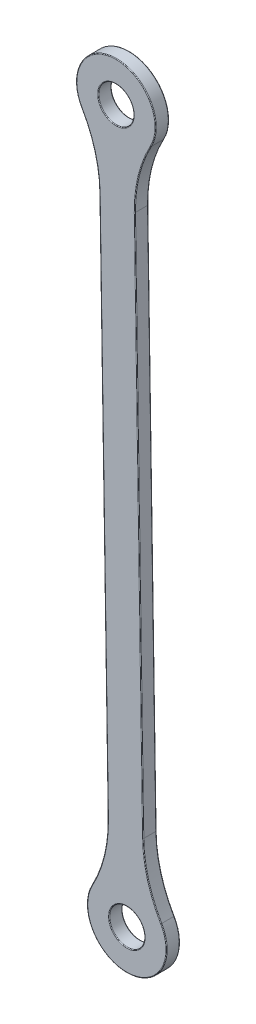
from build123d import *

# Parameters (mm, degrees)
BOSS_EXTRUDE1_DEPTH = 3
FILLET1_R           = 30
FILLET2_R           = 0.15


with BuildPart() as part:
    # Sketch2 → Boss-Extrude1 (new body)
    with BuildSketch(Plane.XY):
        with BuildLine():
            ThreePointArc((40.312003169, 217.259303311), (26.509736802, 224.871020446), (27.436839225, 209.136304824))
            Line((27.436839225, 209.136304824), (27.312479057, 217.197603389))
            ThreePointArc((27.312479057, 217.197603389), (31.250303247, 221.258827422), (35.31152728, 217.321003232))
            Line((35.31152728, 217.321003232), (35.435887448, 209.259704667))
            ThreePointArc((35.435887448, 209.259704667), (38.996889587, 212.575018868), (40.312003169, 217.259303311))
        make_face()
        with BuildLine():
            Line((31.37370309, 213.259779199), (31.450827992, 208.260374059))
            ThreePointArc((31.450827992, 208.260374059), (33.501144014, 208.529603295), (35.435887448, 209.259704667))
            Line((35.435887448, 209.259704667), (35.31152728, 217.321003232))
            ThreePointArc((35.31152728, 217.321003232), (34.183722222, 214.474841123), (31.37370309, 213.259779199))
        make_face()
        with BuildLine():
            ThreePointArc((27.436839225, 209.136304824), (29.393182911, 208.466230536), (31.450827992, 208.260374059))
            Line((31.450827992, 208.260374059), (31.37370309, 213.259779199))
            ThreePointArc((31.37370309, 213.259779199), (28.527540981, 214.387584257), (27.312479057, 217.197603389))
            Line((27.312479057, 217.197603389), (27.436839225, 209.136304824))
        make_face()
        with BuildLine():
            ThreePointArc((29.65611575, 65.277937502), (31.590859184, 66.008038874), (33.641175206, 66.27726811))
            Line((33.641175206, 66.27726811), (31.450827992, 208.260374059))
            ThreePointArc((31.450827992, 208.260374059), (29.393182911, 208.466230536), (27.436839225, 209.136304824))
            Line((27.436839225, 209.136304824), (29.65611575, 65.277937502))
        make_face()
        with BuildLine():
            Line((31.450827992, 208.260374059), (33.641175206, 66.27726811))
            ThreePointArc((33.641175206, 66.27726811), (35.698820288, 66.071411633), (37.655163974, 65.401337345))
            Line((37.655163974, 65.401337345), (35.435887448, 209.259704667))
            ThreePointArc((35.435887448, 209.259704667), (33.501144014, 208.529603295), (31.450827992, 208.260374059))
        make_face()
        with BuildLine():
            ThreePointArc((37.779524141, 57.34003878), (33.841699951, 53.278814747), (29.780475918, 57.216638937))
            Line((29.780475918, 57.216638937), (29.65611575, 65.277937502))
            ThreePointArc((29.65611575, 65.277937502), (29.095715587, 49.593452441), (42.78000003, 57.278338859))
            ThreePointArc((42.78000003, 57.278338859), (41.391717165, 62.080605225), (37.655163974, 65.401337345))
            Line((37.655163974, 65.401337345), (37.779524141, 57.34003878))
        make_face()
        with BuildLine():
            Line((33.641175206, 66.27726811), (33.718300108, 61.27786297))
            ThreePointArc((33.718300108, 61.27786297), (36.564462218, 60.150057912), (37.779524141, 57.34003878))
            Line((37.779524141, 57.34003878), (37.655163974, 65.401337345))
            ThreePointArc((37.655163974, 65.401337345), (35.698820288, 66.071411633), (33.641175206, 66.27726811))
        make_face()
        with BuildLine():
            ThreePointArc((29.780475918, 57.216638937), (30.908280976, 60.062801047), (33.718300108, 61.27786297))
            Line((33.718300108, 61.27786297), (33.641175206, 66.27726811))
            ThreePointArc((33.641175206, 66.27726811), (31.590859184, 66.008038874), (29.65611575, 65.277937502))
            Line((29.65611575, 65.277937502), (29.780475918, 57.216638937))
        make_face()
    extrude(amount=-BOSS_EXTRUDE1_DEPTH)

    # Fillet1
    fillet1_edges = [part.edges().sort_by_distance(p)[0] for p in [
        (29.65611575, 65.277937502, -1.5),
        (27.436839225, 209.136304824, -1.5),
        (35.435887448, 209.259704667, -1.5),
        (37.655163974, 65.401337345, -1.5),
    ]]
    fillet(fillet1_edges, radius=FILLET1_R)

    # Fillet2
    fillet2_edges = [part.edges().sort_by_distance(p)[0] for p in [
        (27.312479057, 217.197603389, -3),
        (28.546477487, 137.207121163, 0),
        (28.546477487, 137.207121163, -3),
        (31.568557037, 48.554261836, 0),
        (31.568557037, 48.554261836, -3),
        (36.545525711, 137.330521006, 0),
        (37.779524141, 57.34003878, -3),
        (36.545525711, 137.330521006, -3),
        (31.173178345, 226.258232562, 0),
        (31.173178345, 226.258232562, -3),
        (28.62559717, 68.70962022, 0),
        (28.62559717, 68.70962022, -3),
        (38.579337489, 68.863174738, 0),
        (38.579337489, 68.863174738, -3),
        (36.466406028, 205.828021949, 0),
        (36.466406028, 205.828021949, -3),
        (26.512665709, 205.674467431, 0),
        (26.512665709, 205.674467431, -3),
        (37.779524141, 57.34003878, 0),
        (27.312479057, 217.197603389, 0),
    ]]
    fillet(fillet2_edges, radius=FILLET2_R)


solid = part.part
